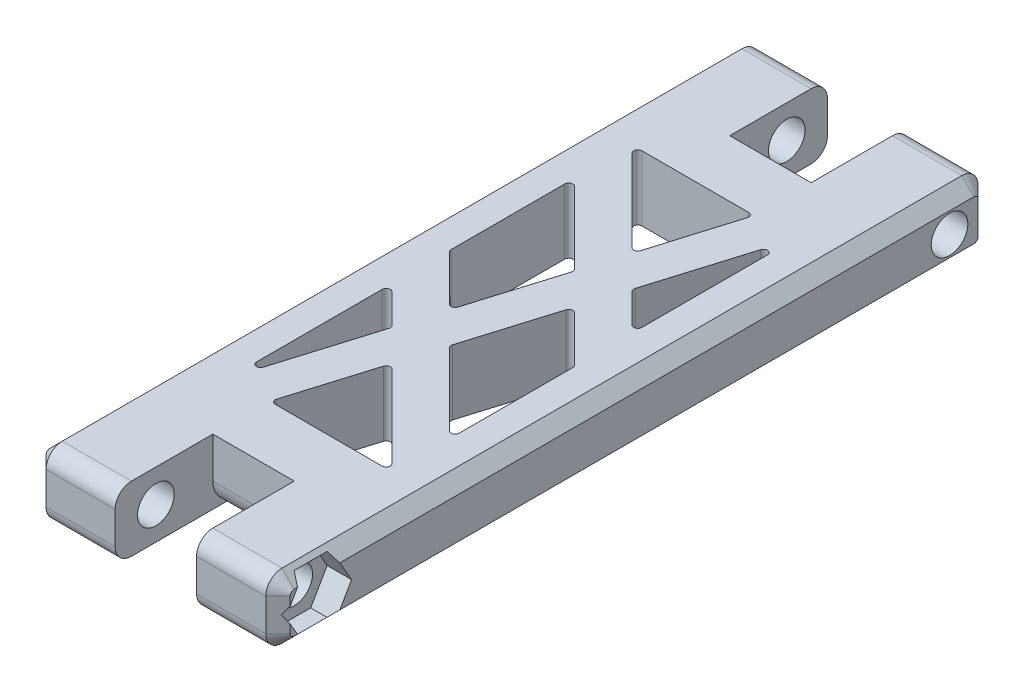
from build123d import *

# Parameters (mm, degrees)
SKETCH1_W           = 30
SKETCH1_H           = 87.5
BOSS_EXTRUDE1_DEPTH = 8
SKETCH2_W           = 10
SKETCH2_H           = 12
CUT_EXTRUDE1_DEPTH  = 8
SKETCH3_R           = 2.25
CUT_EXTRUDE2_DEPTH  = 54.647576833
FILLET1_R           = 2
CUT_EXTRUDE3_DEPTH  = 47.936792605
FILLET2_R           = 3
CHAMFER1_SIZE       = 1.5
FILLET3_R           = 0.5
CUT_EXTRUDE4_DEPTH  = 3


with BuildPart() as part:
    # Sketch1 → Boss-Extrude1 (new body)
    with BuildSketch(Plane(origin=(0, 0, 0), x_dir=(1, 0, 0), z_dir=(0, 1, 0))):
        Rectangle(SKETCH1_W, SKETCH1_H)
    extrude(amount=BOSS_EXTRUDE1_DEPTH)

    # Sketch2 → Cut-Extrude1 (cut)
    with BuildSketch(Plane(origin=(0, 8, 0), x_dir=(1, 0, 0), z_dir=(0, 1, 0))):
        with Locations((0, 37.75)):
            Rectangle(SKETCH2_W, SKETCH2_H)
        with Locations((0, -37.75)):
            Rectangle(SKETCH2_W, SKETCH2_H)
    extrude(amount=-CUT_EXTRUDE1_DEPTH, mode=Mode.SUBTRACT)

    # Sketch3 → Cut-Extrude2 (cut, through all)
    with BuildSketch(Plane(origin=(15, 0, 0), x_dir=(0, 0, -1), z_dir=(1, 0, 0))):
        with Locations((-38.75, 4)):
            Circle(SKETCH3_R)
    cut_extrude2 = extrude(amount=-CUT_EXTRUDE2_DEPTH, mode=Mode.SUBTRACT)

    # Mirror1: Cut-Extrude2 across plane
    add(cut_extrude2.mirror(Plane.XY), mode=Mode.SUBTRACT)

    # Fillet1
    fillet1_edges = [part.edges().sort_by_distance(p)[0] for p in [
        (10, 0, 43.75),
        (-10, 0, -43.75),
        (-10, 8, 43.75),
        (-10, 8, -43.75),
        (10, 8, 43.75),
        (-10, 0, 43.75),
        (10, 0, -43.75),
        (10, 8, -43.75),
    ]]
    fillet(fillet1_edges, radius=FILLET1_R)

    # Sketch4 → Cut-Extrude3 (cut, through all)
    with BuildSketch(Plane(origin=(0, 8, 0), x_dir=(1, 0, 0), z_dir=(0, 1, 0))):
        Polygon((5, 24.75), (-10, 24.75), (1.511627907, 13.238372093), align=None)
        Polygon((10, 4.75), (10, 24.75), (5.348837209, 9.401162791), align=None)
        Polygon((-10, -4.75), (-10, -24.75), (-5.348837209, -9.401162791), align=None)
        Polygon((-5, -24.75), (10, -24.75), (-1.511627907, -13.238372093), align=None)
        Polygon((-10, 17.678932188), (-10, 2.321067812), (-3.704402834, -3.974529354), (-0.132806468, 7.811738656), align=None)
        Polygon((10.032301404, -17.711233593), (10.032301404, -2.353369216), (3.704402834, 3.974529354), (0.132806468, -7.811738656), align=None)
    extrude(amount=-CUT_EXTRUDE3_DEPTH, mode=Mode.SUBTRACT)

    # Fillet2
    fillet2_edges = [part.edges().sort_by_distance(p)[0] for p in [
        (0, 0, -31.75),
        (0, 0, 31.75),
    ]]
    fillet(fillet2_edges, radius=FILLET2_R)

    # Chamfer1
    chamfer1_edges = [part.edges().sort_by_distance(p)[0] for p in [
        (15, 4, -43.75),
        (15, 0, 0),
        (-15, 0, 0),
        (15, 8, 0),
        (15, 4, 43.75),
        (15, 7.414213562, 43.164213562),
        (15, 0.585786438, 43.164213562),
        (15, 7.414213562, -43.164213562),
        (15, 0.585786438, -43.164213562),
        (-15, 8, 0),
        (-15, 4, 43.75),
        (-15, 4, -43.75),
        (-15, 0.585786438, 43.164213562),
        (-15, 7.414213562, 43.164213562),
        (-15, 0.585786438, -43.164213562),
        (-15, 7.414213562, -43.164213562),
    ]]
    chamfer(chamfer1_edges, length=CHAMFER1_SIZE)

    # Fillet3
    fillet3_edges = [part.edges().sort_by_distance(p)[0] for p in [
        (-10, 4, -17.678932188),
        (-0.132806468, 4, -7.811738656),
        (-3.704402834, 4, 3.974529354),
        (-10, 4, -2.321067812),
        (-1.511627907, 4, 13.238372093),
        (10, 4, 24.75),
        (-5, 4, 24.75),
        (10, 4, -4.75),
        (5.348837209, 4, -9.401162791),
        (10, 4, -24.75),
        (-10, 4, 4.75),
        (-5.348837209, 4, 9.401162791),
        (-10, 4, 24.75),
        (10.032301404, 4, 17.711233593),
        (0.132806468, 4, 7.811738656),
        (3.704402834, 4, -3.974529354),
        (10.032301404, 4, 2.353369216),
        (5, 4, -24.75),
        (1.511627907, 4, -13.238372093),
        (-10, 4, -24.75),
    ]]
    fillet(fillet3_edges, radius=FILLET3_R)

    # Sketch5 → Cut-Extrude4 (cut)
    with BuildSketch(Plane(origin=(15, 0, 0), x_dir=(0, 0, -1), z_dir=(1, 0, 0))):
        Polygon((-34.708548116, 4), (-36.729274058, 7.5), (-40.770725942, 7.5), (-42.791451884, 4), (-40.770725942, 0.5), (-36.729274058, 0.5), align=None)
    extrude(amount=-CUT_EXTRUDE4_DEPTH, mode=Mode.SUBTRACT)


solid = part.part
